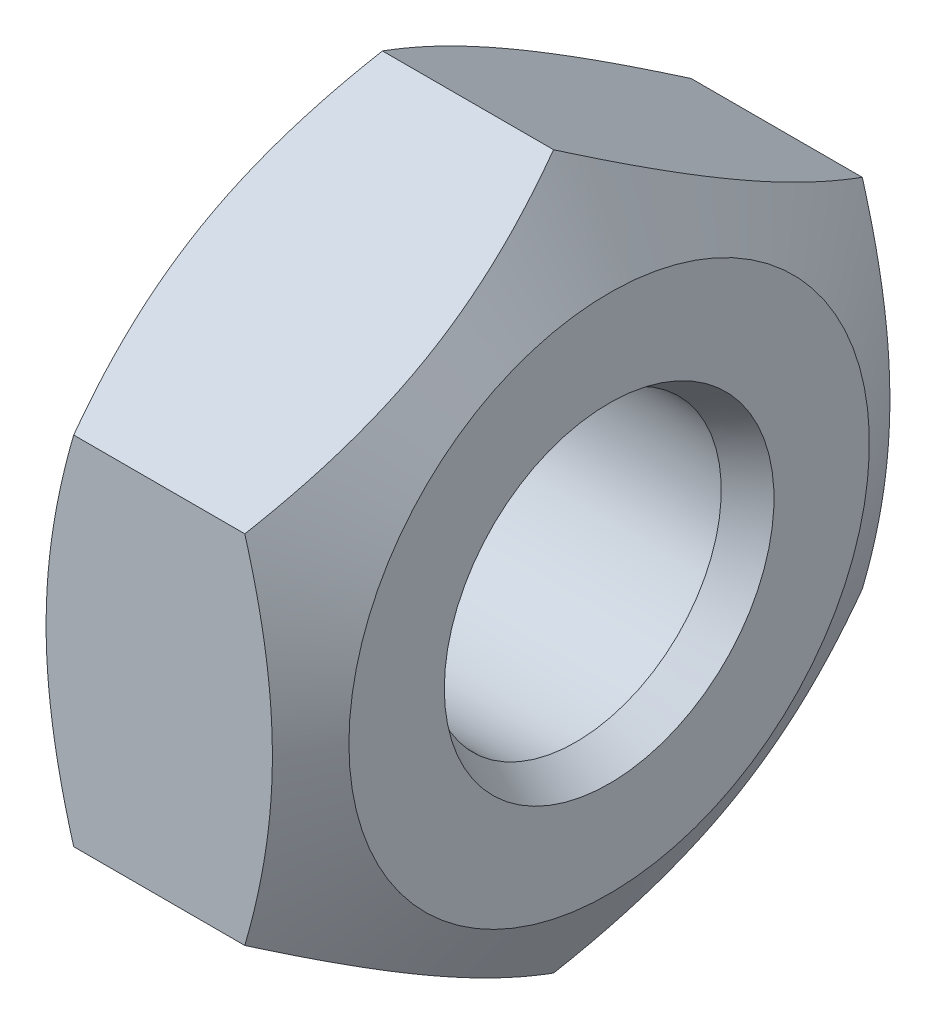
from build123d import *
from OCP.BRepFilletAPI import BRepFilletAPI_MakeChamfer

# Parameters (mm, degrees)
BODY_DEPTH     = 3.2
THREAD_D       = 3.3
CHAMFER3_SIZE  = 0.378886114
CHAMFER3_SIZE2 = 0.21875


with BuildPart() as part:
    # Sketch1 → Body (new body)
    with BuildSketch(Plane.YZ):
        Polygon((-4.041451884, 0), (-2.020725942, 3.5), (2.020725942, 3.5), (4.041451884, 0), (2.020725942, -3.5), (-2.020725942, -3.5), align=None)
    extrude(amount=BODY_DEPTH)

    # Sketch2 → Chamfer1 (revolve, cut)
    with BuildSketch(Plane.XY, mode=Mode.PRIVATE) as chamfer1_sk:
        Polygon((0, 2.95), (0.630150039, 4.041451884), (0, 4.041451884), align=None)
        Polygon((3.2, 2.95), (3.2, 4.041451884), (2.569849961, 4.041451884), align=None)
    revolve(chamfer1_sk.sketch.rotate(Axis((-0.64, 0, 0), (1, 0, 0)), 300.000000005), axis=Axis((-0.64, 0, 0), (1, 0, 0)), mode=Mode.SUBTRACT)

    # Thread (through all)
    with Locations(Plane(origin=(3.2, 0, 0), x_dir=(0, 0, -1), z_dir=(1, 0, 0))):
        with Locations((0, 0)):
            Hole(THREAD_D / 2)

    # Chamfer3: one chamfer whose edges measure the first distance from different faces: ONE call of the kernel's chamfer builder (chamfer() names one face for all edges)
    chamfer3_edges_1 = [part.edges().sort_by_distance(p)[0] for p in [
        (3.2, 0, -1.65),
    ]]
    chamfer3_side_1 = [part.faces().sort_by_distance(p)[0] for p in [
        (1.6, 0, -1.65),
    ]]
    chamfer3_edges_2 = [part.edges().sort_by_distance(p)[0] for p in [
        (0, 0, -1.65),
    ]]
    chamfer3_side_2 = [part.faces().sort_by_distance(p)[0] for p in [
        (0, -1.4332807, 2.482514994),
    ]]
    chamfer3 = BRepFilletAPI_MakeChamfer(part.part.solid().wrapped)
    for e in chamfer3_edges_1:
        chamfer3.Add(CHAMFER3_SIZE, CHAMFER3_SIZE2, e.wrapped, chamfer3_side_1[0].wrapped)  # the first distance lies on this face
    for e in chamfer3_edges_2:
        chamfer3.Add(CHAMFER3_SIZE, CHAMFER3_SIZE2, e.wrapped, chamfer3_side_2[0].wrapped)  # the first distance lies on this face
    add(Compound.cast(chamfer3.Shape()), mode=Mode.REPLACE)


solid = part.part
